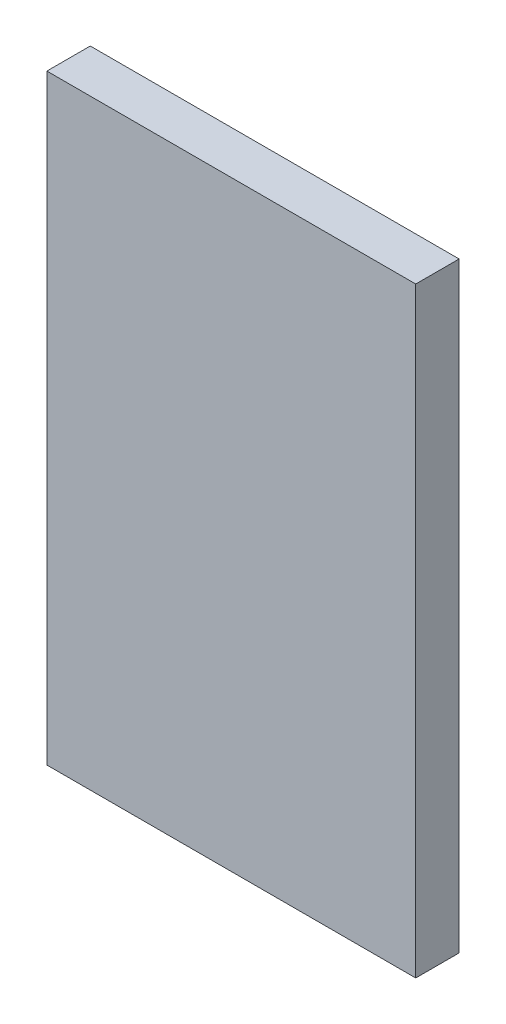
from build123d import *

# Parameters (mm, degrees)
CROQUIS1_W              = 17
CROQUIS1_H              = 27.7
SALIENTE_EXTRUIR1_DEPTH = 2


with BuildPart() as part:
    # Croquis1 → Saliente-Extruir1 (new body)
    with BuildSketch(Plane.XY):
        Rectangle(CROQUIS1_W, CROQUIS1_H)
    extrude(amount=SALIENTE_EXTRUIR1_DEPTH)


solid = part.part
